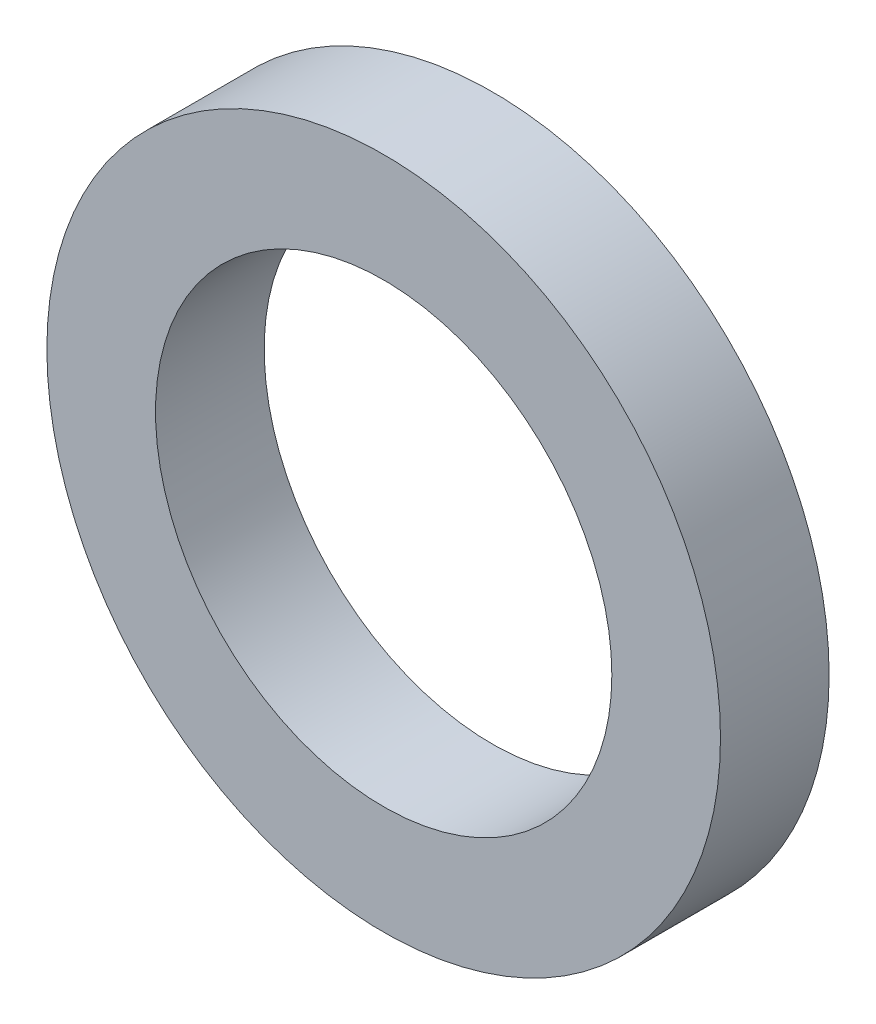
from build123d import *

# Parameters (mm, degrees)
SKETCH2_R           = 3.1
BOSS_EXTRUDE1_DEPTH = 1
SKETCH3_R           = 2.1
CUT_EXTRUDE1_DEPTH  = 5.496665431


with BuildPart() as part:
    # Sketch2 → Boss-Extrude1 (new body)
    with BuildSketch(Plane.XY):
        Circle(SKETCH2_R)
    extrude(amount=BOSS_EXTRUDE1_DEPTH)

    # Sketch3 → Cut-Extrude1 (cut, through all)
    with BuildSketch(Plane.XY.offset(1)):
        Circle(SKETCH3_R)
    extrude(amount=-CUT_EXTRUDE1_DEPTH, mode=Mode.SUBTRACT)


solid = part.part
